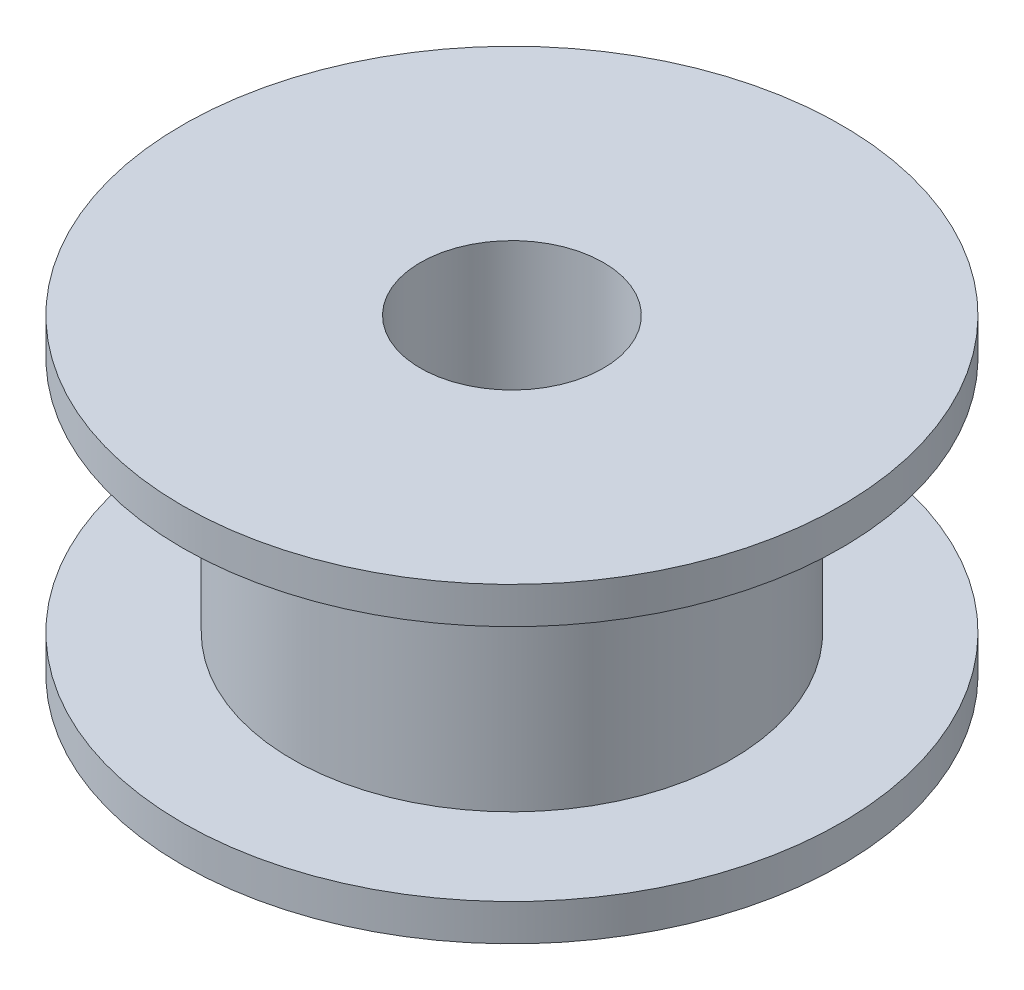
from build123d import *

# Parameters (mm, degrees)
SKETCH_1_R          = 9
EXTRUDE_1_DEPTH     = 1
SKETCH_2_R          = 6
EXTRUDE_2_DEPTH     = 6.5
SKETCH_5_R          = 9
EXTRUDE_3_DEPTH     = 1
SKETCH_6_R          = 2.5
CUT_EXTRUDE_1_DEPTH = 16.305227865


with BuildPart() as part:
    # 草图1 → 凸台-拉伸1 (new body)
    with BuildSketch(Plane(origin=(0, 0, 0), x_dir=(1, 0, 0), z_dir=(0, 1, 0))):
        with Locations(Location((0, 0, 0), (0, 0, 270))):
            Circle(SKETCH_1_R)
    extrude(amount=EXTRUDE_1_DEPTH)

    # 草图2 → 凸台-拉伸2 (add)
    with BuildSketch(Plane(origin=(0, 1, 0), x_dir=(1, 0, 0), z_dir=(0, 1, 0))):
        with Locations(Location((0, 0, 0), (0, 0, 90))):
            Circle(SKETCH_2_R)
    extrude(amount=EXTRUDE_2_DEPTH)

    # 草图5 → 凸台-拉伸3 (add)
    with BuildSketch(Plane(origin=(0, 7.5, 0), x_dir=(1, 0, 0), z_dir=(0, 1, 0))):
        with Locations(Location((0, 0, 0), (0, 0, 270))):
            Circle(SKETCH_5_R)
    extrude(amount=EXTRUDE_3_DEPTH)

    # 草图6 → 切除-拉伸1 (cut, through all)
    with BuildSketch(Plane.XZ):
        with Locations(Location((0, 0, 0), (0, 0, 270))):
            Circle(SKETCH_6_R)
    extrude(amount=-CUT_EXTRUDE_1_DEPTH, mode=Mode.SUBTRACT)


solid = part.part
